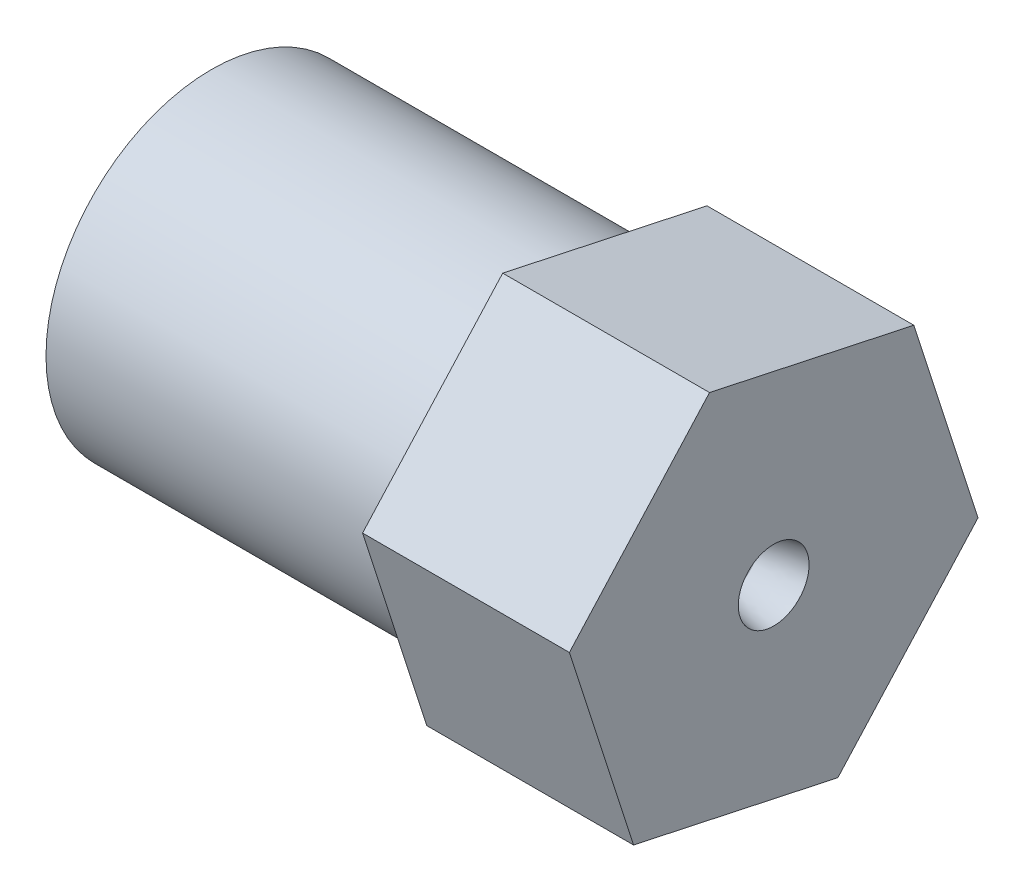
from build123d import *

# Parameters (mm, degrees)
SKETCH4_R           = 10.16
BOSS_EXTRUDE1_DEPTH = 12.7
FILLET1_R           = 0.635


with BuildPart() as part:
    # Sketch1 → Revolve1 (revolve)
    with BuildSketch(Plane.XY, mode=Mode.PRIVATE) as revolve1_sk:
        with BuildLine():
            Line((-1.590990258, 2.159009742), (-2.947044546, 3.51506403))
            ThreePointArc((-2.947044546, 3.51506403), (-3.977088678, 4.203317516), (-5.192108576, 4.445))
            Line((-5.192108576, 4.445), (-13.462, 4.445))
            Line((-13.462, 4.445), (-13.462, 4.699))
            ThreePointArc((-13.462, 4.699), (-13.499197439, 4.788802561), (-13.589, 4.826))
            Line((-13.589, 4.826), (-19.304, 4.826))
            ThreePointArc((-19.304, 4.826), (-19.753012806, 5.011987194), (-19.939, 5.461))
            Line((-19.939, 5.461), (-19.939, 6.8199))
            ThreePointArc((-19.939, 6.8199), (-19.976197439, 6.909702561), (-20.066, 6.9469))
            Line((-20.066, 6.9469), (-24.892, 6.9469))
            Line((-24.892, 6.9469), (-24.892, 7.8994))
            ThreePointArc((-24.892, 7.8994), (-24.929197439, 7.989202561), (-25.019, 8.0264))
            Line((-25.019, 8.0264), (-31.115, 8.0264))
            ThreePointArc((-31.115, 8.0264), (-31.564012806, 8.212387194), (-31.75, 8.6614))
            Line((-31.75, 8.6614), (-31.75, 10.16))
            Line((-31.75, 10.16), (-9.925119796, 10.16))
            Line((-9.925119796, 10.16), (2.774880204, 10.16))
            Line((2.774880204, 10.16), (2.774880204, 2.173706512))
            add(Edge.make_bspline(
                [(2.774880204, 2.173706512), (1.442196935, 1.986410093), (0.205212086, 1.536184427)],
                knots=[0, 0, 0, 1, 1, 1], degree=2))
            ThreePointArc((0.205212086, 1.536184427), (0.104188907, 1.509115348), (0, 1.5))
            ThreePointArc((0, 1.5), (-0.861037723, 1.671271052), (-1.590990258, 2.159009742))
        make_face()
    revolve(revolve1_sk.sketch.rotate(Axis((0, 0, 0), (1, 0, 0)), 90), axis=Axis((0, 0, 0), (1, 0, 0)))

    # Sketch4 → Boss-Extrude1 (add)
    with BuildSketch(Plane(origin=(2.774880204, 0, 0), x_dir=(0, 0, -1), z_dir=(1, 0, 0))):
        Polygon((3.940411868, -12.211607701), (12.545768424, -2.693307071), (8.605356556, 9.51830063), (-3.940411868, 12.211607701), (-12.545768424, 2.693307071), (-8.605356556, -9.51830063), align=None)
        with Locations(Location((0, 0, 0), (0, 0, 180))):
            Circle(SKETCH4_R, mode=Mode.SUBTRACT)
    extrude(amount=-BOSS_EXTRUDE1_DEPTH)

    # Fillet1
    fillet1_edges = [part.edges().sort_by_distance(p)[0] for p in [
        (-9.925119796, 0, -10.16),
    ]]
    fillet(fillet1_edges, radius=FILLET1_R)


solid = part.part
